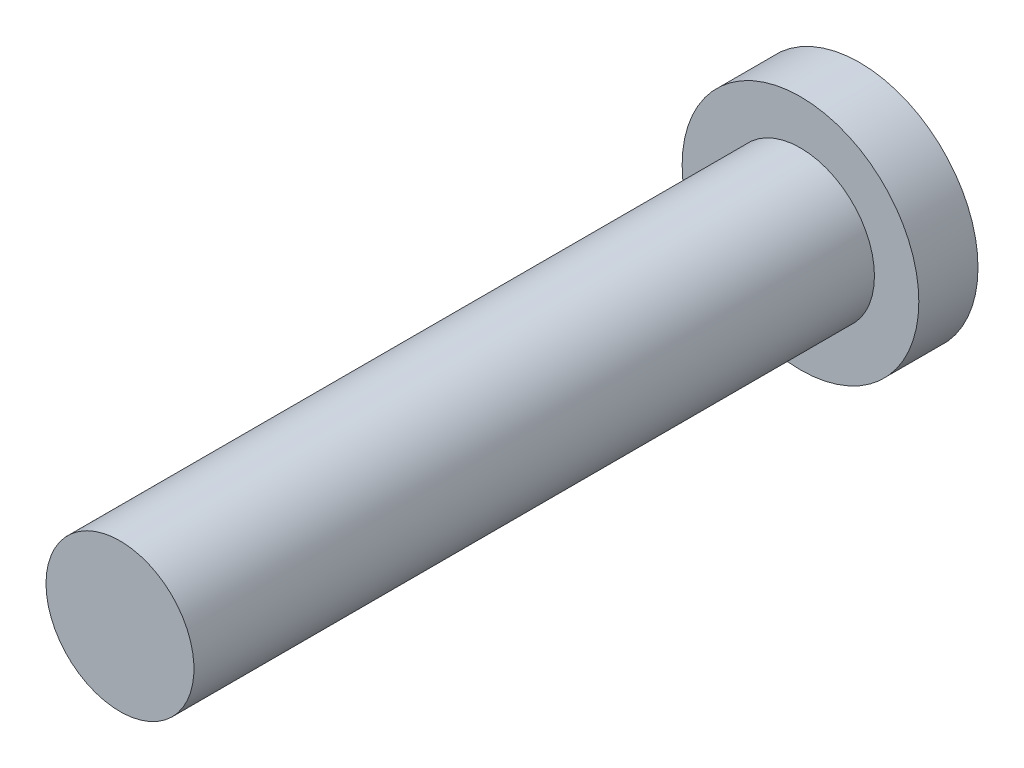
from build123d import *

# Parameters (mm, degrees)
SKICA1_R                = 4
P_IDAT_VYSUNUT_M2_DEPTH = 2
SKICA2_R                = 2.5
P_IDAT_VYSUNUT_M3_DEPTH = 25


with BuildPart() as part:
    # Skica1 → Přidat vysunutím2 (new body)
    with BuildSketch(Plane.XY):
        Circle(SKICA1_R)
    extrude(amount=P_IDAT_VYSUNUT_M2_DEPTH)

    # Skica2 → Přidat vysunutím3 (add)
    with BuildSketch(Plane(origin=(0, 0, 0), x_dir=(-1, 0, 0), z_dir=(0, 0, -1))):
        Circle(SKICA2_R)
    extrude(amount=-P_IDAT_VYSUNUT_M3_DEPTH)


solid = part.part
